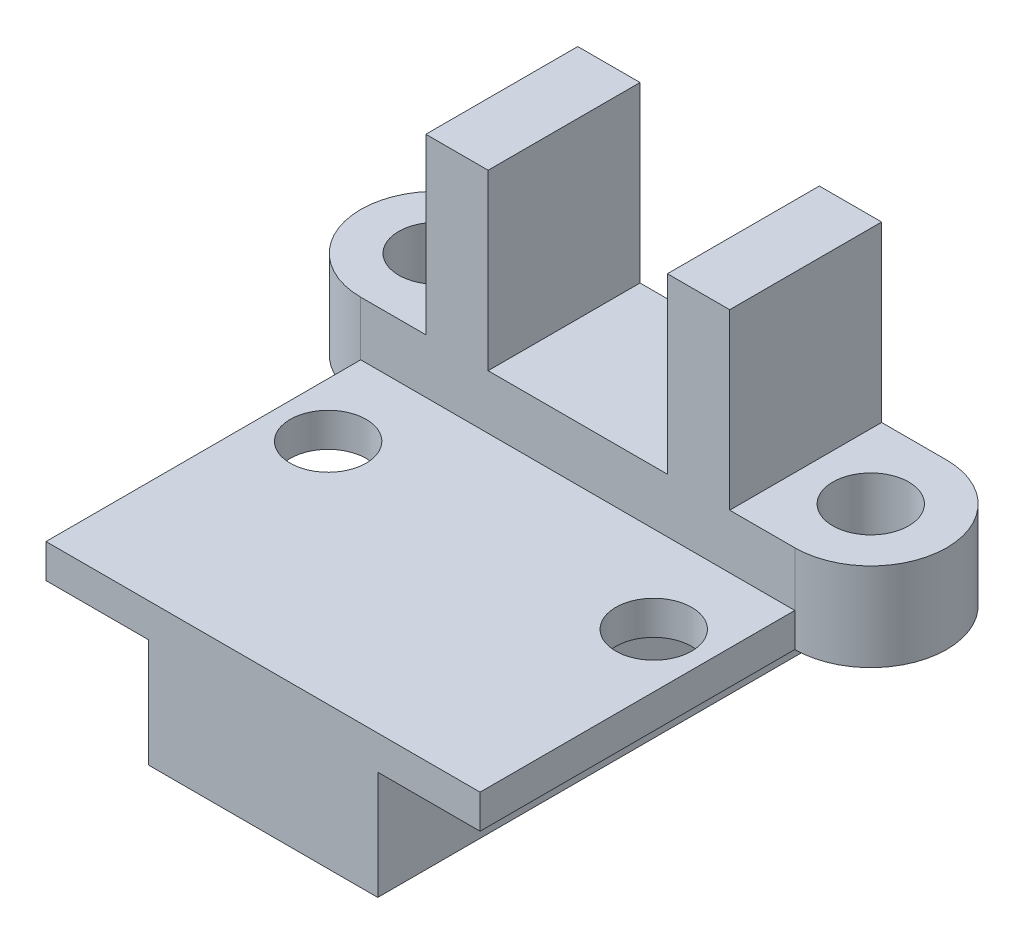
from build123d import *

# Parameters (mm, degrees)
SKETCH1_R           = 1.75
BOSS_EXTRUDE1_DEPTH = 1.56
SKETCH2_R           = 1.75
BOSS_EXTRUDE2_DEPTH = 2.5
SKETCH3_W           = 14
SKETCH3_H           = 7
BOSS_EXTRUDE3_DEPTH = 8
SKETCH4_W           = 8.26
SKETCH4_H           = 7
CUT_EXTRUDE1_DEPTH  = 8
BOSS_EXTRUDE4_DEPTH = 5


with BuildPart() as part:
    # Sketch1 → Boss-Extrude1 (new body)
    with BuildSketch(Plane(origin=(0, 0, 0), x_dir=(1, 0, 0), z_dir=(0, 1, 0))):
        with BuildLine():
            Line((-10, 14.25), (10, 14.25))
            ThreePointArc((10, 14.25), (13.5, 10.75), (10, 7.25))
            Line((10, 7.25), (10, -7.25))
            Line((10, -7.25), (-10, -7.25))
            Line((-10, -7.25), (-10, 7.25))
            ThreePointArc((-10, 7.25), (-13.5, 10.75), (-10, 14.25))
        make_face()
        with Locations(Location((-10, 10.75, 0), (0, 0, 90))):
            Circle(SKETCH1_R, mode=Mode.SUBTRACT)
        with Locations(Location((10, 10.75, 0), (0, 0, 90))):
            Circle(SKETCH1_R, mode=Mode.SUBTRACT)
        with Locations(Location((-7.5, 3.25, 0), (0, 0, 90))):
            Circle(SKETCH1_R, mode=Mode.SUBTRACT)
        with Locations(Location((7.5, 3.25, 0), (0, 0, 90))):
            Circle(SKETCH1_R, mode=Mode.SUBTRACT)
    extrude(amount=BOSS_EXTRUDE1_DEPTH)

    # Sketch2 → Boss-Extrude2 (add)
    with BuildSketch(Plane(origin=(0, 1.56, 0), x_dir=(1, 0, 0), z_dir=(0, 1, 0))):
        with BuildLine():
            Line((-10, 14.25), (10, 14.25))
            ThreePointArc((10, 14.25), (13.5, 10.75), (10, 7.25))
            Line((10, 7.25), (-10, 7.25))
            ThreePointArc((-10, 7.25), (-13.5, 10.75), (-10, 14.25))
        make_face()
        with Locations(Location((-10, 10.75, 0), (0, 0, 90))):
            Circle(SKETCH2_R, mode=Mode.SUBTRACT)
        with Locations(Location((10, 10.75, 0), (0, 0, 90))):
            Circle(SKETCH2_R, mode=Mode.SUBTRACT)
    extrude(amount=BOSS_EXTRUDE2_DEPTH)

    # Sketch3 → Boss-Extrude3 (add)
    with BuildSketch(Plane(origin=(0, 4.06, 0), x_dir=(1, 0, 0), z_dir=(0, 1, 0))):
        with Locations((0, 10.75)):
            Rectangle(SKETCH3_W, SKETCH3_H)
    extrude(amount=BOSS_EXTRUDE3_DEPTH)

    # Sketch4 → Cut-Extrude1 (cut)
    with BuildSketch(Plane(origin=(0, 12.06, 0), x_dir=(1, 0, 0), z_dir=(0, 1, 0))):
        with Locations((0, 10.75)):
            Rectangle(SKETCH4_W, SKETCH4_H)
    extrude(amount=-CUT_EXTRUDE1_DEPTH, mode=Mode.SUBTRACT)

    # Sketch5 → Boss-Extrude4 (add)
    with BuildSketch(Plane.XZ):
        Polygon((-5.285984698, -7.25), (-5.285984698, -14.25), (5.285984698, -14.25), (5.285984698, -7.25), (5.285984698, 7.25), (-5.285984698, 7.25), align=None)
    extrude(amount=BOSS_EXTRUDE4_DEPTH)


solid = part.part
